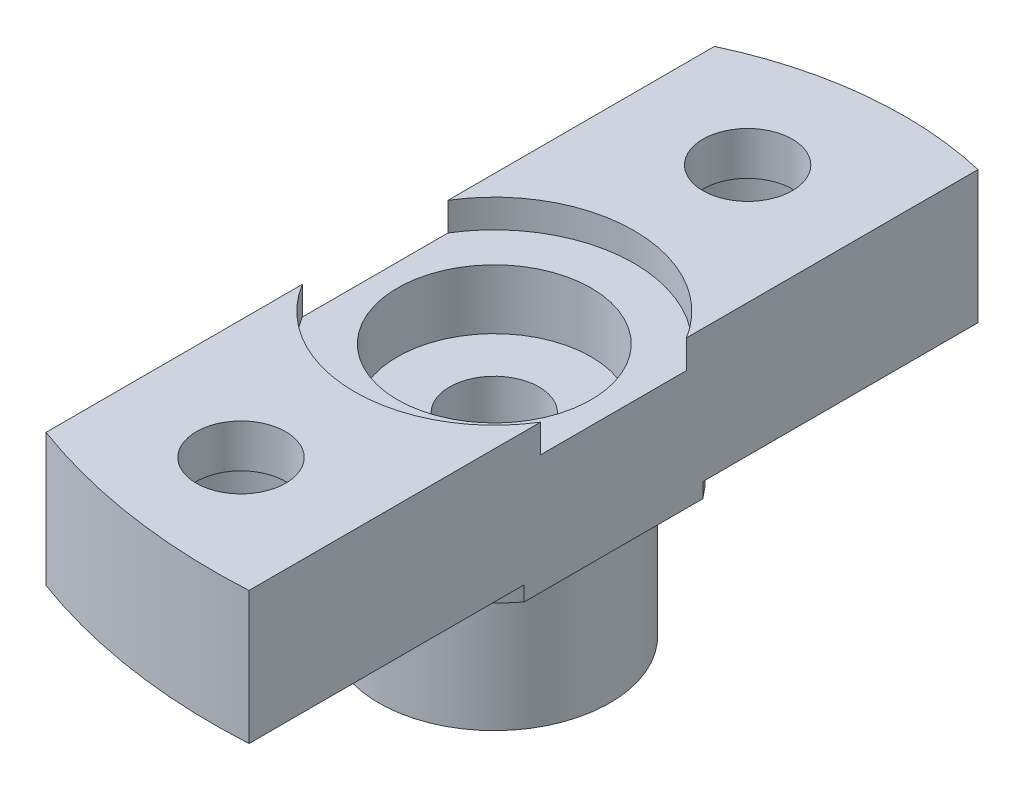
from build123d import *

# Parameters (mm, degrees)
SKETCH1_R                = 1.524
SKETCH1_R_2              = 1.27
SKETCH1_R_3              = 0.762
BOSS_EXTRUDE1_DEPTH      = 2.032
SKETCH1_3_R              = 1.27
SKETCH1_3_R_2            = 0.762
CUT_EXTRUDE1_DEPTH       = 1.524
SKETCH3_R                = 1.651
CUT_EXTRUDE2_DEPTH       = 0.254
SKETCH3_3_R              = 1.651
CUT_EXTRUDE3_DEPTH       = 2.032
SKETCH4_R                = 1.9685
BOSS_EXTRUDE2_DEPTH      = 0.254
BOSS_EXTRUDE3_DEPTH      = 2.54
BOSS_EXTRUDE3_DEPTH_BACK = 0.762
SKETCH4_3_R              = 1.9685
SKETCH4_3_R_2            = 1.651
SKETCH4_3_R_3            = 0.762
CUT_EXTRUDE4_DEPTH       = 2.032
SKETCH10_R               = 0.762
BOSS_EXTRUDE4_DEPTH      = 0.2286


with BuildPart() as part:
    # Sketch1 → Boss-Extrude1 (new body)
    # profile 1 of 7: a face of its own
    with BuildSketch(Plane(origin=(0, 0, 0), x_dir=(1, 0, 0), z_dir=(0, 1, 0))):
        with BuildLine():
            Line((2.032, -6.212875778), (2.032, -1.24150214))
            ThreePointArc((2.032, -1.24150214), (0, -2.38125), (-2.032, -1.24150214))
            Line((-2.032, -1.24150214), (-2.032, -6.206396707))
            ThreePointArc((-2.032, -6.206396707), (-0.877113637, -6.887720967), (0.461163405, -6.804175651))
            Line((0.461163405, -6.804175651), (2.032, -6.212875778))
        make_face()
        with Locations((0, -4.318)):
            Circle(SKETCH1_R, mode=Mode.SUBTRACT)
    # profile 2 of 7: a face of its own
    with BuildSketch(Plane(origin=(0, 0, 0), x_dir=(1, 0, 0), z_dir=(0, 1, 0))):
        with BuildLine():
            Line((2.032, 1.24150214), (2.032, 6.212875778))
            Line((2.032, 6.212875778), (0.461163405, 6.804175651))
            ThreePointArc((0.461163405, 6.804175651), (-0.877113637, 6.887720967), (-2.032, 6.206396707))
            Line((-2.032, 6.206396707), (-2.032, 1.24150214))
            ThreePointArc((-2.032, 1.24150214), (0, 2.38125), (2.032, 1.24150214))
        make_face()
        with Locations((0, 4.318)):
            Circle(SKETCH1_R, mode=Mode.SUBTRACT)
    # profile 3 of 7: a face of its own
    with BuildSketch(Plane(origin=(0, 0, 0), x_dir=(1, 0, 0), z_dir=(0, 1, 0))):
        with BuildLine():
            Line((2.032, -1.24150214), (2.032, 1.24150214))
            ThreePointArc((2.032, 1.24150214), (0, 2.38125), (-2.032, 1.24150214))
            Line((-2.032, 1.24150214), (-2.032, -1.24150214))
            ThreePointArc((-2.032, -1.24150214), (0, -2.38125), (2.032, -1.24150214))
        make_face()
    # profile 4 of 7: a face of its own
    with BuildSketch(Plane(origin=(0, 0, 0), x_dir=(1, 0, 0), z_dir=(0, 1, 0))):
        with Locations((0, -4.318)):
            Circle(SKETCH1_R)
        with Locations((0, -4.318)):
            Circle(SKETCH1_R_2, mode=Mode.SUBTRACT)
    # profile 5 of 7: a face of its own
    with BuildSketch(Plane(origin=(0, 0, 0), x_dir=(1, 0, 0), z_dir=(0, 1, 0))):
        with Locations((0, -4.318)):
            Circle(SKETCH1_R_2)
        with Locations(Location((0, -4.318, 0), (0, 0, 270))):
            Circle(SKETCH1_R_3, mode=Mode.SUBTRACT)
    # profile 6 of 7: a face of its own
    with BuildSketch(Plane(origin=(0, 0, 0), x_dir=(1, 0, 0), z_dir=(0, 1, 0))):
        with Locations((0, 4.318)):
            Circle(SKETCH1_R)
        with Locations((0, 4.318)):
            Circle(SKETCH1_R_2, mode=Mode.SUBTRACT)
    # profile 7 of 7: a face of its own
    with BuildSketch(Plane(origin=(0, 0, 0), x_dir=(1, 0, 0), z_dir=(0, 1, 0))):
        with Locations((0, 4.318)):
            Circle(SKETCH1_R_2)
        with Locations(Location((0, 4.318, 0), (0, 0, 270))):
            Circle(SKETCH1_R_3, mode=Mode.SUBTRACT)
    extrude(amount=BOSS_EXTRUDE1_DEPTH)

    # Sketch1<3> → Cut-Extrude1 (cut)
    # profile 1 of 2: a face of its own
    with BuildSketch(Plane(origin=(0, 0, 0), x_dir=(1, 0, 0), z_dir=(0, 1, 0))):
        with Locations(Location((0, -4.318, 0), (0, 0, 90))):
            Circle(SKETCH1_3_R)
        with Locations(Location((0, -4.318, 0), (0, 0, 270))):
            Circle(SKETCH1_3_R_2, mode=Mode.SUBTRACT)
    # profile 2 of 2: a face of its own
    with BuildSketch(Plane(origin=(0, 0, 0), x_dir=(1, 0, 0), z_dir=(0, 1, 0))):
        with Locations(Location((0, 4.318, 0), (0, 0, 90))):
            Circle(SKETCH1_3_R)
        with Locations(Location((0, 4.318, 0), (0, 0, 270))):
            Circle(SKETCH1_3_R_2, mode=Mode.SUBTRACT)
    extrude(amount=CUT_EXTRUDE1_DEPTH, mode=Mode.SUBTRACT)

    # Sketch3 → Cut-Extrude2 (cut)
    # profile 1 of 2: a face of its own
    with BuildSketch(Plane(origin=(0, 2.032, 0), x_dir=(1, 0, 0), z_dir=(0, 1, 0))):
        with BuildLine():
            Line((2.032, -1.24150214), (2.032, 1.24150214))
            ThreePointArc((2.032, 1.24150214), (0, 2.38125), (-2.032, 1.24150214))
            Line((-2.032, 1.24150214), (-2.032, -1.24150214))
            ThreePointArc((-2.032, -1.24150214), (0, -2.38125), (2.032, -1.24150214))
        make_face()
        Circle(SKETCH3_R, mode=Mode.SUBTRACT)
    # profile 2 of 2: a face of its own
    with BuildSketch(Plane(origin=(0, 2.032, 0), x_dir=(1, 0, 0), z_dir=(0, 1, 0))):
        Circle(SKETCH3_R)
    extrude(amount=-CUT_EXTRUDE2_DEPTH, mode=Mode.SUBTRACT)

    # Sketch3<3> → Cut-Extrude3 (cut)
    with BuildSketch(Plane(origin=(0, 2.032, 0), x_dir=(1, 0, 0), z_dir=(0, 1, 0))):
        with Locations(Location((0, 0, 0), (0, 0, 270))):
            Circle(SKETCH3_3_R)
    extrude(amount=-CUT_EXTRUDE3_DEPTH, mode=Mode.SUBTRACT)

    # Sketch4 → Boss-Extrude2 (add)
    with BuildSketch(Plane.XZ):
        with BuildLine():
            Line((2.032, -1.524), (2.032, 1.524))
            ThreePointArc((2.032, 1.524), (0, 2.54), (-2.032, 1.524))
            Line((-2.032, 1.524), (-2.032, -1.524))
            ThreePointArc((-2.032, -1.524), (0, -2.54), (2.032, -1.524))
        make_face()
        with Locations(Location((0, 0, 0), (0, 0, 270))):
            Circle(SKETCH4_R, mode=Mode.SUBTRACT)
    extrude(amount=BOSS_EXTRUDE2_DEPTH)

    # Sketch4<3> → Boss-Extrude3 (add, two sides: drawn at the far end of the back side and taken through both)
    # profile 1 of 2: a face of its own
    with BuildSketch(Plane.XZ.offset(-BOSS_EXTRUDE3_DEPTH_BACK)):
        with Locations(Location((0, 0, 0), (0, 0, 270))):
            Circle(SKETCH4_3_R)
        with Locations(Location((0, 0, 0), (0, 0, 90))):
            Circle(SKETCH4_3_R_2, mode=Mode.SUBTRACT)
    # profile 2 of 2: a face of its own
    with BuildSketch(Plane.XZ.offset(-BOSS_EXTRUDE3_DEPTH_BACK)):
        with Locations(Location((0, 0, 0), (0, 0, 90))):
            Circle(SKETCH4_3_R_2)
        with Locations(Location((0, 0, 0), (0, 0, 270))):
            Circle(SKETCH4_3_R_3, mode=Mode.SUBTRACT)
    extrude(amount=BOSS_EXTRUDE3_DEPTH + BOSS_EXTRUDE3_DEPTH_BACK)

    # Sketch6 → Cut-Extrude4 (cut)
    with BuildSketch(Plane.XZ):
        with BuildLine():
            Line((-2.032, 5.609449291), (-2.032, 6.206396707))
            ThreePointArc((-2.032, 6.206396707), (-0.003234375, 8.238399289), (2.032, 6.212875778))
            ThreePointArc((2.032, 6.212875778), (-0.031260659, 6.121699066), (-2.032, 5.609449291))
        make_face()
        with BuildLine():
            Line((-2.032, -5.784926759), (-2.032, -6.206396707))
            ThreePointArc((-2.032, -6.206396707), (-0.001969351, -7.444912354), (2.032, -6.212875778))
            ThreePointArc((2.032, -6.212875778), (-0.036162052, -6.342312682), (-2.032, -5.784926759))
        make_face()
    extrude(amount=-CUT_EXTRUDE4_DEPTH, mode=Mode.SUBTRACT)

    # Sketch10 → Boss-Extrude4 (add)
    # profile 1 of 2: a face of its own
    with BuildSketch(Plane(origin=(0, 2.032, 0), x_dir=(1, 0, 0), z_dir=(0, 1, 0))):
        with BuildLine():
            Line((-2.032, -1.24150214), (-2.032, -5.609449291))
            ThreePointArc((-2.032, -5.609449291), (-0.031260659, -6.121699066), (2.032, -6.212875778))
            Line((2.032, -6.212875778), (2.032, -1.24150214))
            ThreePointArc((2.032, -1.24150214), (0, -2.38125), (-2.032, -1.24150214))
        make_face()
        with Locations((0, -4.318)):
            Circle(SKETCH10_R, mode=Mode.SUBTRACT)
    # profile 2 of 2: a face of its own
    with BuildSketch(Plane(origin=(0, 2.032, 0), x_dir=(1, 0, 0), z_dir=(0, 1, 0))):
        with BuildLine():
            Line((-2.032, 5.784926759), (-2.032, 1.24150214))
            ThreePointArc((-2.032, 1.24150214), (0, 2.38125), (2.032, 1.24150214))
            Line((2.032, 1.24150214), (2.032, 6.212875778))
            ThreePointArc((2.032, 6.212875778), (-0.036162052, 6.342312682), (-2.032, 5.784926759))
        make_face()
        with Locations((0, 4.318)):
            Circle(SKETCH10_R, mode=Mode.SUBTRACT)
    extrude(amount=BOSS_EXTRUDE4_DEPTH)


solid = part.part
